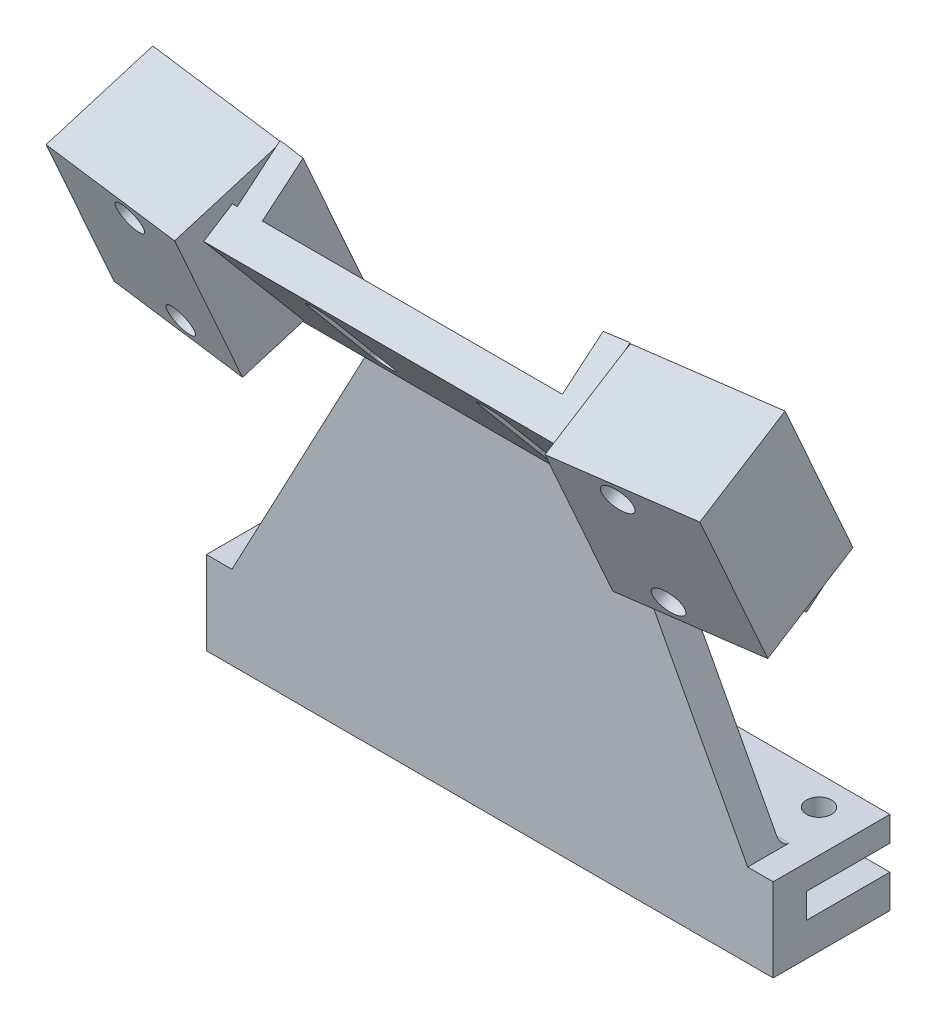
from build123d import *

# Parameters (mm, degrees)
EXTRUDE_1_DEPTH     = 68
SKETCH_2_R          = 1.5
CUT_EXTRUDE_1_DEPTH = 60
SKETCH_3_W          = 30
SKETCH_3_H          = 4
EXTRUDE_2_DEPTH     = 40
EXTRUDE_3_DEPTH     = 30
CUT_EXTRUDE_2_DEPTH = 4
EXTRUDE_4_DEPTH     = 23
EXTRUDE_START       = -53
EXTRUDE_5_DEPTH     = 23
EXTRUDE_6_DEPTH     = 3
EXTRUDE_7_DEPTH     = 0.66666
SKETCH_17_W         = 17.087989765
SKETCH_17_H         = 19.996406133
EXTRUDE_9_DEPTH     = 12
SKETCH_19_R         = 1.8
CUT_EXTRUDE_3_DEPTH = 20
SKETCH_20_W         = 61.603006609
SKETCH_20_H         = 84.586869481
CUT_EXTRUDE_4_DEPTH = 65
SKETCH_21_W         = 7.494214953
SKETCH_21_H         = 26.873102225
CUT_EXTRUDE_5_DEPTH = 2
SKETCH_22_W         = 9.970658679
SKETCH_22_H         = 25.794738871
CUT_EXTRUDE_6_DEPTH = 2
EXTRUDE_10_DEPTH    = 4
FILLET_1_R          = 1
FILLET_2_R          = 1


with BuildPart() as part:
    # 草图1 → 凸台-拉伸1 (new body)
    with BuildSketch(Plane(origin=(0, 0, 0), x_dir=(0, 0, -1), z_dir=(1, 0, 0))):
        Polygon((0, 0), (0, 4), (-10, 4), (-10, 7), (0, 7), (0, 10), (-14, 10), (-14, 0), align=None)
    extrude(amount=EXTRUDE_1_DEPTH)

    # 草图2 → 切除-拉伸1 (cut)
    with BuildSketch(Plane(origin=(0, 10, 0), x_dir=(1, 0, 0), z_dir=(0, 1, 0))):
        with Locations(Location((5, -3.5, 0), (0, 0, 270))):
            Circle(SKETCH_2_R)
        with Locations(Location((63, -3.5, 0), (0, 0, 270))):
            Circle(SKETCH_2_R)
    extrude(amount=-CUT_EXTRUDE_1_DEPTH, mode=Mode.SUBTRACT)

    # 草图3 → 凸台-拉伸2 (add)
    with BuildSketch(Plane.XZ):
        with Locations((34, 12)):
            Rectangle(SKETCH_3_W, SKETCH_3_H)
    extrude(amount=-EXTRUDE_2_DEPTH)

    # 草图4 → 凸台-拉伸3 (add)
    with BuildSketch(Plane(origin=(49, 0, 0), x_dir=(0, 0, -1), z_dir=(1, 0, 0))):
        Polygon((-14, 40), (-26.357684131, 54.727314459), (-23.293506358, 57.298464898), (-10, 41.455880937), (-10, 40), align=None)
    extrude(amount=-EXTRUDE_3_DEPTH)

    # 草图5 → 切除-拉伸2 (cut)
    with BuildSketch(Plane(origin=(0, 9.633382176, -11.480617817), x_dir=(1, 0, 0), z_dir=(0, -0.6427876096865429, 0.7660444431189751))):
        with BuildLine():
            Line((25.25, 55.318123989), (25.25, 43.864814933))
            ThreePointArc((25.25, 43.864814933), (23.75, 42.364814933), (22.25, 43.864814933))
            Line((22.25, 43.864814933), (22.25, 55.318123989))
            ThreePointArc((22.25, 55.318123989), (23.75, 56.818123989), (25.25, 55.318123989))
        make_face()
        with BuildLine():
            Line((42.75, 55.318123989), (42.75, 43.864814933))
            ThreePointArc((42.75, 43.864814933), (44.25, 42.364814933), (45.75, 43.864814933))
            Line((45.75, 43.864814933), (45.75, 55.318123989))
            ThreePointArc((45.75, 55.318123989), (44.25, 56.818123989), (42.75, 55.318123989))
        make_face()
    extrude(amount=-CUT_EXTRUDE_2_DEPTH, mode=Mode.SUBTRACT)

    # 草图6 → 凸台-拉伸4 (add)
    with BuildSketch(Plane.ZY.offset(-19)):
        Polygon((23.293506358, 57.298464898), (26.357684131, 54.727314459), (14, 40), (10.935822228, 42.571150439), align=None)
    extrude(amount=EXTRUDE_4_DEPTH)

    # 草图7 → 凸台-拉伸5 (add)
    with BuildSketch(Plane.ZY.offset(4).offset(EXTRUDE_START)):
        Polygon((23.293506358, 57.298464898), (26.357684131, 54.727314459), (14, 40), (10.935822228, 42.571150439), align=None)
    extrude(amount=-EXTRUDE_5_DEPTH)

    # 草图10 → 凸台-拉伸6 (add)
    with BuildSketch(Plane(origin=(52, 0, 0), x_dir=(0, 0.7660444431189749, 0.6427876096865431), z_dir=(-1, 0, 0))):
        Polygon((39.64080426, 18.986882184), (58.865947907, 18.986882184), (58.865947907, 25.653542184), (39.64080426, 20.653542184), align=None)
    extrude(amount=-EXTRUDE_6_DEPTH)

    # 草图15 → 凸台-拉伸7 (add)
    with BuildSketch(Plane(origin=(-0.224740323, 0.898508111, -2.01476807), x_dir=(0.9948507831271028, 0.04127952147527669, -0.09256306184522162), z_dir=(0.10135047760810084, -0.4051975406133526, 0.9085939873064868))):
        Polygon((55.510576319, 63.468125115), (55.510576319, 62.353864223), (55.510576319, 43.471718982), (72.598566084, 43.471718982), (72.598566084, 62.353864223), (72.598566084, 63.468125115), align=None)
    extrude(amount=-EXTRUDE_7_DEPTH)

    # 草图17 → 凸台-拉伸9 (add)
    with BuildSketch(Plane(origin=(-0.224740323, 0.898508111, -2.01476807), x_dir=(0.994850783127103, 0.04127952147527699, -0.09256306184522194), z_dir=(0.10135047760810126, -0.40519754061335256, 0.9085939873064869))):
        with Locations((64.054571201, 53.469922049)):
            Rectangle(SKETCH_17_W, SKETCH_17_H)
    extrude(amount=EXTRUDE_9_DEPTH)

    # 草图19 → 切除-拉伸3 (cut)
    with BuildSketch(Plane(origin=(-0.292306632, 1.168637103, -2.620491338), x_dir=(-0.9948507831271028, -0.04127952147527692, 0.09256306184522202), z_dir=(-0.10135047760810131, 0.40519754061335245, -0.908593987306487))):
        with Locations(Location((-62.598566084, 60.969922048, 0), (0, 0, 90))):
            Circle(SKETCH_19_R)
        with Locations(Location((-62.598566084, 45.969922048, 0), (0, 0, 270))):
            Circle(SKETCH_19_R)
    extrude(amount=-CUT_EXTRUDE_3_DEPTH, mode=Mode.SUBTRACT)

    # 草图20 → 切除-拉伸4 (cut)
    with BuildSketch(Plane.ZY.offset(-34)):
        with Locations((16.944749698, 32.191708304)):
            Rectangle(SKETCH_20_W, SKETCH_20_H)
    extrude(amount=CUT_EXTRUDE_4_DEPTH, mode=Mode.SUBTRACT)

    # 镜向7: part across plane


with BuildPart() as part_1:
    add(part.part)
    add(part.part.mirror(Plane.ZY.offset(-34)))

    # 草图21 → 切除-拉伸5 (cut)
    with BuildSketch(Plane(origin=(-0.292306632, 1.168637103, -2.620491338), x_dir=(-0.9948507831271028, -0.04127952147527692, 0.09256306184522202), z_dir=(-0.10135047760810131, 0.40519754061335245, -0.908593987306487))):
        with Locations((-54.514442647, 53.802326892)):
            Rectangle(SKETCH_21_W, SKETCH_21_H)
    extrude(amount=CUT_EXTRUDE_5_DEPTH, mode=Mode.SUBTRACT)

    # 草图22 → 切除-拉伸6 (cut)
    with BuildSketch(Plane(origin=(0.990797146, 3.961190673, -8.882368888), x_dir=(-0.9948507831271028, 0.04127952147527693, -0.09256306184522203), z_dir=(0.10135047760810131, 0.40519754061335256, -0.9085939873064868))):
        with Locations((-12.026553315, 54.032339334)):
            Rectangle(SKETCH_22_W, SKETCH_22_H)
    extrude(amount=CUT_EXTRUDE_6_DEPTH, mode=Mode.SUBTRACT)

    # 草图24 → 凸台-拉伸10 (add)
    with BuildSketch(Plane.XY.offset(14)):
        Polygon((19, 40), (3.059166743, 10), (8.395226669, 10), (19, 10), (19, 29.957752195), align=None)
        Polygon((49, 29.957752195), (49, 10), (59.604773331, 10), (64.940833257, 10), (49, 40), align=None)
    extrude(amount=-EXTRUDE_10_DEPTH)

    # 圆角1
    fillet_1_edges = [part_1.edges().sort_by_distance(p)[0] for p in [
        (34, 10, 10),
    ]]
    fillet(fillet_1_edges, radius=FILLET_1_R)

    # 圆角2
    fillet_2_edges = [part_1.edges().sort_by_distance(p)[0] for p in [
        (34, 41.455880937, 10),
    ]]
    fillet(fillet_2_edges, radius=FILLET_2_R)


solid = part_1.part
